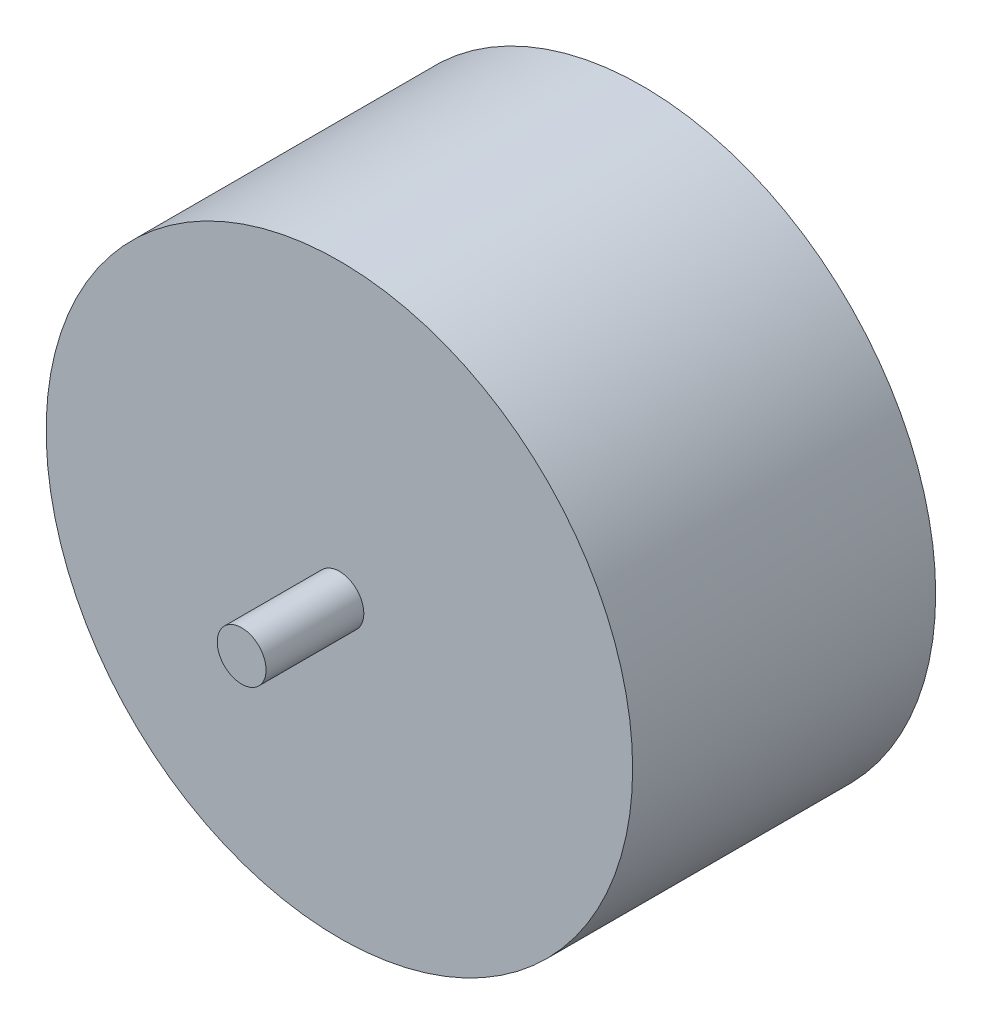
from build123d import *

# Parameters (mm, degrees)
SKETCH_2_R      = 30
EXTRUDE_1_DEPTH = 31
SKETCH_3_R      = 2.5
EXTRUDE_2_DEPTH = 10


with BuildPart() as part:
    # 草图2 → 凸台-拉伸1 (new body)
    with BuildSketch(Plane.XY):
        Circle(SKETCH_2_R)
    extrude(amount=EXTRUDE_1_DEPTH)

    # 草图3 → 凸台-拉伸2 (add)
    with BuildSketch(Plane.XY.offset(31)):
        Circle(SKETCH_3_R)
    extrude(amount=EXTRUDE_2_DEPTH)


solid = part.part
